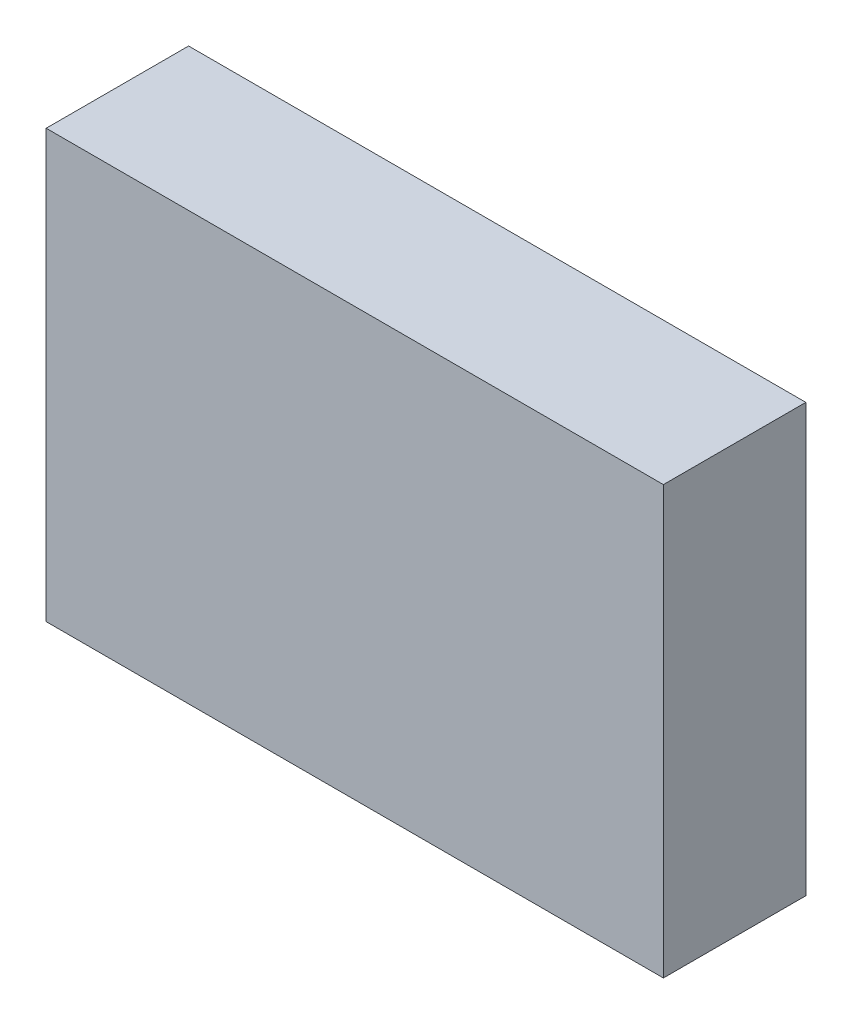
from build123d import *

# Parameters (mm, degrees)
SKETCH1_W           = 165.1
SKETCH1_H           = 114.3
BOSS_EXTRUDE1_DEPTH = 38.1


with BuildPart() as part:
    # Sketch1 → Boss-Extrude1 (new body)
    with BuildSketch(Plane.XY):
        Rectangle(SKETCH1_W, SKETCH1_H)
    extrude(amount=BOSS_EXTRUDE1_DEPTH)


solid = part.part
